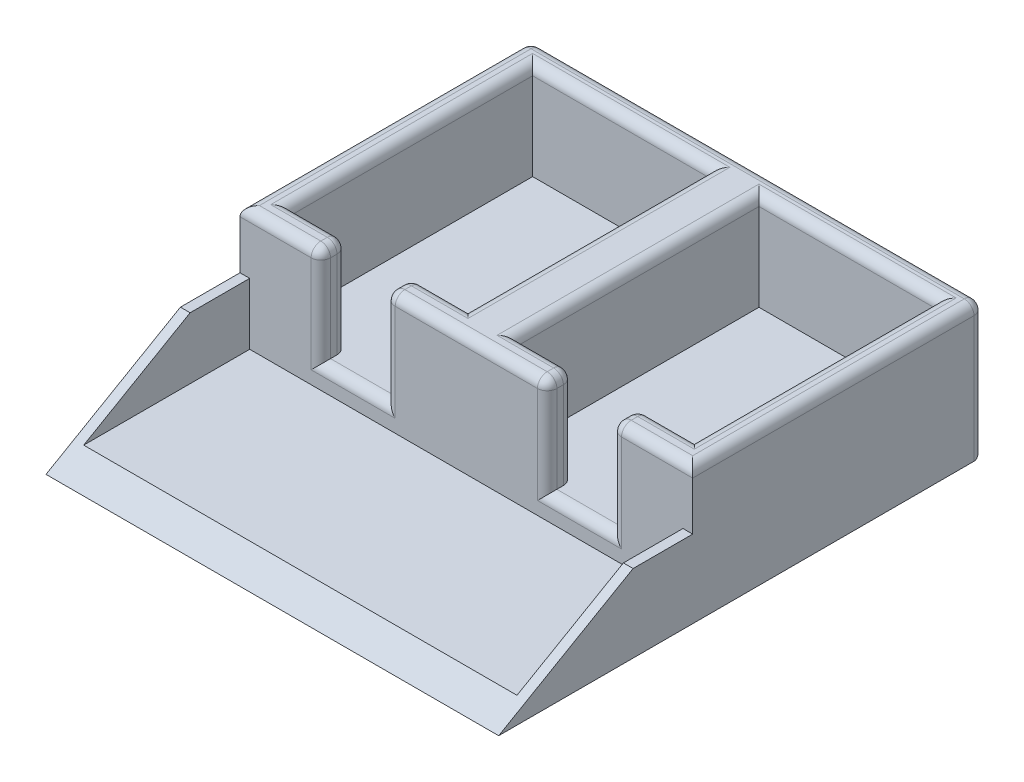
from build123d import *

# Parameters (mm, degrees)
SKETCH1_W               = 140
SKETCH1_H               = 90
BOSS_EXTRUDE1_DEPTH     = 42
CUT_EXTRUDE1_DEPTH      = 30
FILLET2_R               = 3
SKETCH3_W               = 140
SKETCH3_H               = 60
BOSS_EXTRUDE2_DEPTH     = 5
SKETCH4_W               = 3
SKETCH4_H               = 60
BOSS_EXTRUDE3_DEPTH     = 19
CUT_EXTRUDE2_DEPTH      = 172.650808329
CUT_EXTRUDE2_DEPTH_BACK = 172.650808329


with BuildPart() as part:
    # Sketch1 → Boss-Extrude1 (new body)
    with BuildSketch(Plane(origin=(0, 0, 0), x_dir=(1, 0, 0), z_dir=(0, 1, 0))):
        with Locations((70, 45)):
            Rectangle(SKETCH1_W, SKETCH1_H)
    extrude(amount=BOSS_EXTRUDE1_DEPTH)

    # Sketch2 → Cut-Extrude1 (cut)
    with BuildSketch(Plane(origin=(0, 42, 0), x_dir=(1, 0, 0), z_dir=(0, 1, 0))):
        Polygon((7.5, 8), (7.5, 83), (62.5, 83), (62.5, 8), (45, 8), (45, 0), (25, 0), (25, 8), align=None)
        Polygon((77.5, 8), (77.5, 83), (132.5, 83), (132.5, 8), (115, 8), (115, 0), (95, 0), (95, 8), align=None)
    extrude(amount=-CUT_EXTRUDE1_DEPTH, mode=Mode.SUBTRACT)

    # Fillet2
    fillet2_edges = [part.edges().sort_by_distance(p)[0] for p in [
        (140, 42, -45),
        (70, 42, 0),
        (127.5, 42, 0),
        (70, 42, -90),
        (25, 27, -8),
        (45, 27, -8),
        (35, 12, 0),
        (45, 27, 0),
        (25, 27, 0),
        (16.25, 42, -8),
        (25, 42, -4),
        (45, 42, -4),
        (53.75, 42, -8),
        (62.5, 42, -45.5),
        (35, 42, -83),
        (7.5, 42, -45.5),
        (95, 27, -8),
        (115, 27, -8),
        (105, 12, 0),
        (115, 27, 0),
        (95, 27, 0),
        (86.25, 42, -8),
        (95, 42, -4),
        (115, 42, -4),
        (123.75, 42, -8),
        (132.5, 42, -45.5),
        (105, 42, -83),
        (77.5, 42, -45.5),
        (0, 42, -45),
        (70, 0, -90),
        (0, 21, -90),
        (140, 21, -90),
        (12.5, 42, 0),
    ]]
    fillet(fillet2_edges, radius=FILLET2_R)

    # Sketch3 → Boss-Extrude2 (add)
    with BuildSketch(Plane(origin=(0, 0, 0), x_dir=(1, 0, 0), z_dir=(0, 1, 0))):
        with Locations((70, -30)):
            Rectangle(SKETCH3_W, SKETCH3_H)
    extrude(amount=BOSS_EXTRUDE2_DEPTH)

    # Sketch4 → Boss-Extrude3 (add)
    with BuildSketch(Plane(origin=(0, 5, 0), x_dir=(1, 0, 0), z_dir=(0, 1, 0))):
        with Locations((1.5, -30)):
            Rectangle(SKETCH4_W, SKETCH4_H)
        with Locations((138.5, -30)):
            Rectangle(SKETCH4_W, SKETCH4_H)
    extrude(amount=BOSS_EXTRUDE3_DEPTH)

    # Sketch5 → Cut-Extrude2 (cut, two sides: drawn at the far end of the back side and taken through both)
    with BuildSketch(Plane.ZY.offset(-CUT_EXTRUDE2_DEPTH_BACK)):
        Polygon((60, 0), (8.038475773, 30), (60, 30), align=None)
    extrude(amount=CUT_EXTRUDE2_DEPTH + CUT_EXTRUDE2_DEPTH_BACK, mode=Mode.SUBTRACT)


solid = part.part
